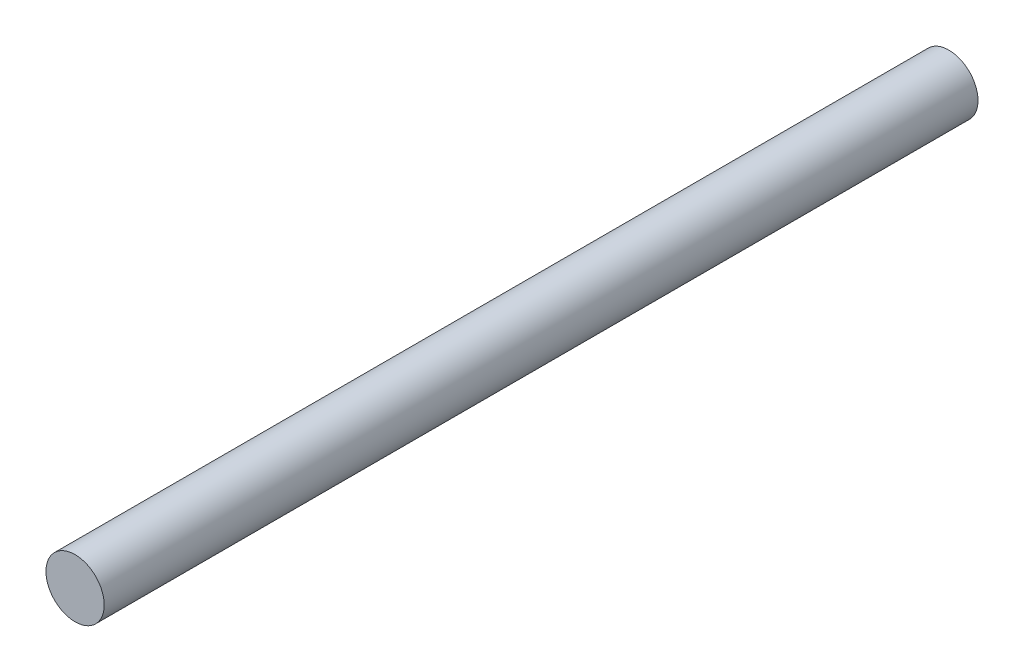
from build123d import *

# Parameters (mm, degrees)
SKETCH1_R           = 4
BOSS_EXTRUDE1_DEPTH = 60


with BuildPart() as part:
    # Sketch1 → Boss-Extrude1 (new, symmetric)
    with BuildSketch(Plane.XY):
        Circle(SKETCH1_R)
    extrude(amount=BOSS_EXTRUDE1_DEPTH, both=True)


solid = part.part
